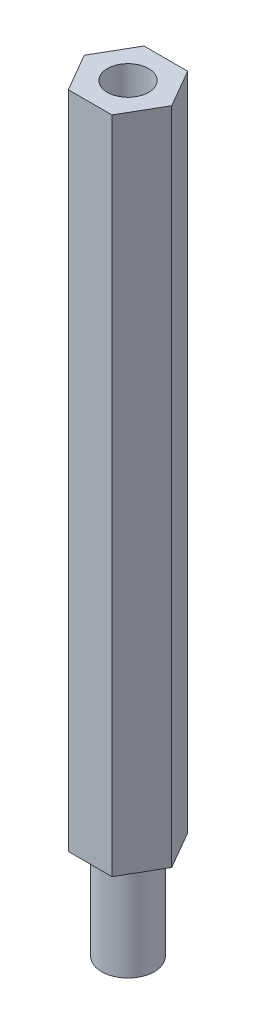
from build123d import *

# Parameters (mm, degrees)
EXTRUDE_1_DEPTH     = 40
SKETCH_6_R          = 1.6
EXTRUDE_2_DEPTH     = 6
SKETCH_7_R          = 1.25
CUT_EXTRUDE_1_DEPTH = 5


with BuildPart() as part:
    # 草图4 → 凸台-拉伸1 (new body)
    with BuildSketch(Plane(origin=(0, 0, 0), x_dir=(1, 0, 0), z_dir=(0, 1, 0))):
        Polygon((1.325, -2.29496732), (2.65, 0), (1.325, 2.29496732), (-1.325, 2.29496732), (-2.65, 0), (-1.325, -2.29496732), align=None)
    extrude(amount=EXTRUDE_1_DEPTH)

    # 草图6 → 凸台-拉伸2 (add)
    with BuildSketch(Plane(origin=(0, 0, 0), x_dir=(-1, 0, 0), z_dir=(0, -1, 0))):
        with Locations(Location((0, 0, 0), (0, 0, 270))):
            Circle(SKETCH_6_R)
    extrude(amount=EXTRUDE_2_DEPTH)

    # 草图7 → 切除-拉伸1 (cut)
    with BuildSketch(Plane(origin=(0, 40, 0), x_dir=(1, 0, 0), z_dir=(0, 1, 0))):
        with Locations(Location((0, 0, 0), (0, 0, 270))):
            Circle(SKETCH_7_R)
    extrude(amount=-CUT_EXTRUDE_1_DEPTH, mode=Mode.SUBTRACT)


solid = part.part
